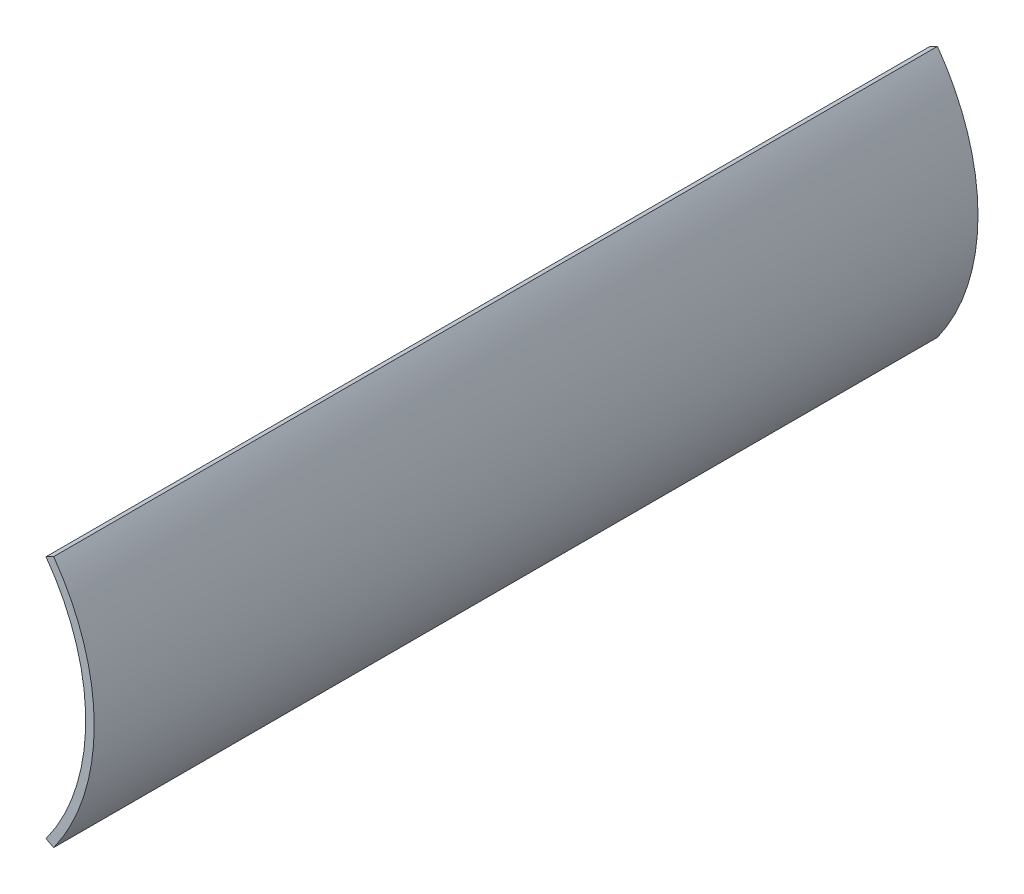
from build123d import *

# Parameters (mm, degrees)
EXTRUDE_1_DEPTH = 208


with BuildPart() as part:
    # Эскиз1 → Бобышка-Вытянуть1 (new body)
    with BuildSketch(Plane.XY):
        with BuildLine():
            Line((-4.159412849, 28.964936307), (-2.359075662, 29.888331168))
            ThreePointArc((-2.359075662, 29.888331168), (7.188189231, 0.230828682), (-2.359074488, -29.426674183))
            Line((-2.359074488, -29.426674183), (-4.159411664, -28.503279327))
            ThreePointArc((-4.159411664, -28.503279327), (5.188189231, 0.230828683), (-4.159412849, 28.964936307))
        make_face()
    extrude(amount=EXTRUDE_1_DEPTH)


solid = part.part
